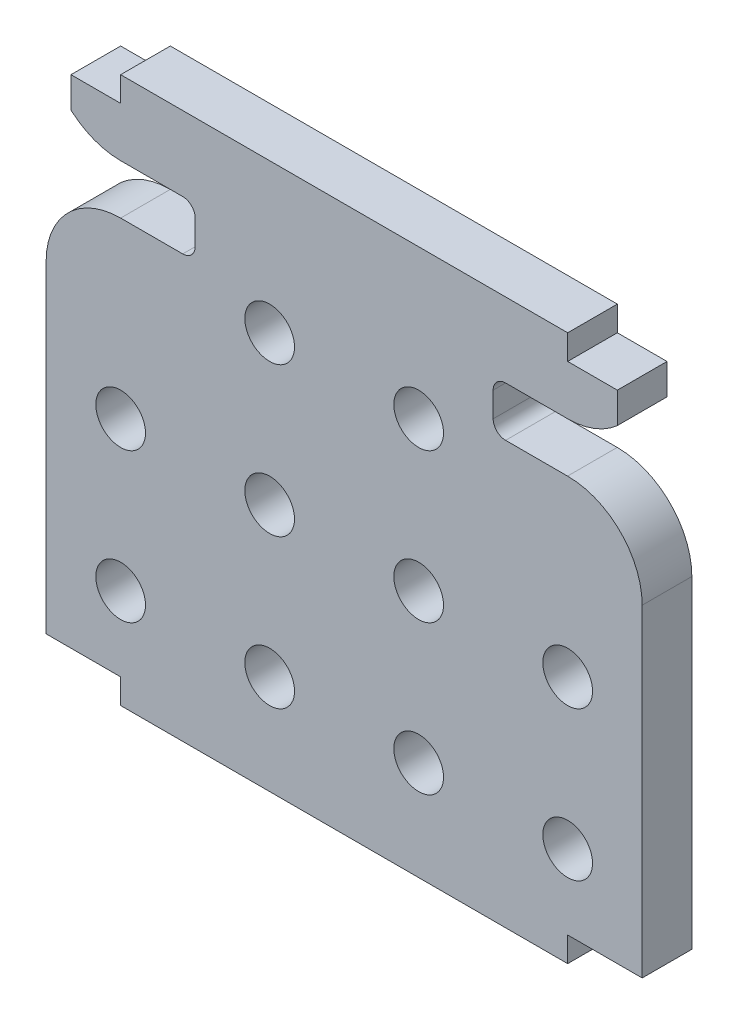
from build123d import *

# Parameters (mm, degrees)
MODEL_R                 = 1.5
SALIENTE_EXTRUIR1_DEPTH = 3


with BuildPart() as part:
    # Model → Saliente-Extruir1 (new body)
    with BuildSketch(Plane.XY):
        with BuildLine():
            Line((110.375172306, 212.589330986), (110.375172306, 211.089330986))
            Line((110.375172306, 211.089330986), (107.375172306, 211.089330986))
            Line((107.375172306, 211.089330986), (107.375172306, 209.23522902))
            ThreePointArc((107.375172306, 209.23522902), (108.769472902, 208.385555371), (110.375172306, 208.089330986))
            Line((110.375172306, 208.089330986), (114.125172656, 208.089330986))
            ThreePointArc((114.125172656, 208.089330986), (114.655502742, 207.869661072), (114.875172656, 207.339330986))
            Line((114.875172656, 207.339330986), (114.875172656, 205.839330986))
            ThreePointArc((114.875172656, 205.839330986), (114.655502742, 205.3090009), (114.125172656, 205.089330986))
            Line((114.125172656, 205.089330986), (110.375172306, 205.089330986))
            ThreePointArc((110.375172306, 205.089330986), (107.192564198, 203.770683786), (105.875172656, 200.587555713))
            Line((105.875172656, 200.587555713), (105.875172656, 181.089330986))
            Line((105.875172656, 181.089330986), (110.375172306, 181.089330986))
            Line((110.375172306, 181.089330986), (110.375172306, 179.589330986))
            Line((110.375172306, 179.589330986), (137.375172656, 179.589330986))
            Line((137.375172656, 179.589330986), (137.375172656, 181.089330986))
            Line((137.375172656, 181.089330986), (141.875172656, 181.089330986))
            Line((141.875172656, 181.089330986), (141.875172306, 200.589330986))
            ThreePointArc((141.875172306, 200.589330986), (140.554536331, 203.773925842), (137.367774797, 205.089324906))
            Line((137.367774797, 205.089324906), (133.625176703, 205.089319857))
            ThreePointArc((133.625176703, 205.089319857), (133.09484632, 205.308989056), (132.875175691, 205.839318846))
            Line((132.875175691, 205.839318846), (132.875173667, 207.339318846))
            ThreePointArc((132.875173667, 207.339318846), (133.094842866, 207.869649228), (133.625172656, 208.089319857))
            Line((133.625172656, 208.089319857), (137.375178726, 208.089324916))
            ThreePointArc((137.375178726, 208.089324916), (138.980875531, 208.385553219), (140.375172656, 209.23522902))
            Line((140.375172656, 209.23522902), (140.375172656, 211.089330986))
            Line((140.375172656, 211.089330986), (137.375172656, 211.089330986))
            Line((137.375172656, 211.089330986), (137.375165869, 212.589324916))
            Line((137.375165869, 212.589324916), (110.375172306, 212.589330986))
        make_face()
        with Locations((110.375172306, 185.589330986)):
            Circle(MODEL_R, mode=Mode.SUBTRACT)
        with Locations((119.375172306, 185.589330986)):
            Circle(MODEL_R, mode=Mode.SUBTRACT)
        with Locations((110.375172306, 194.589330986)):
            Circle(MODEL_R, mode=Mode.SUBTRACT)
        with Locations((119.375172306, 194.589330986)):
            Circle(MODEL_R, mode=Mode.SUBTRACT)
        with Locations((128.375172306, 185.589330986)):
            Circle(MODEL_R, mode=Mode.SUBTRACT)
        with Locations((137.375172306, 185.589330986)):
            Circle(MODEL_R, mode=Mode.SUBTRACT)
        with Locations((128.375172306, 194.589330986)):
            Circle(MODEL_R, mode=Mode.SUBTRACT)
        with Locations((137.375172306, 194.589330986)):
            Circle(MODEL_R, mode=Mode.SUBTRACT)
        with Locations((119.375172656, 203.589330986)):
            Circle(MODEL_R, mode=Mode.SUBTRACT)
        with Locations((128.375172656, 203.589330986)):
            Circle(MODEL_R, mode=Mode.SUBTRACT)
    extrude(amount=SALIENTE_EXTRUIR1_DEPTH)


solid = part.part
